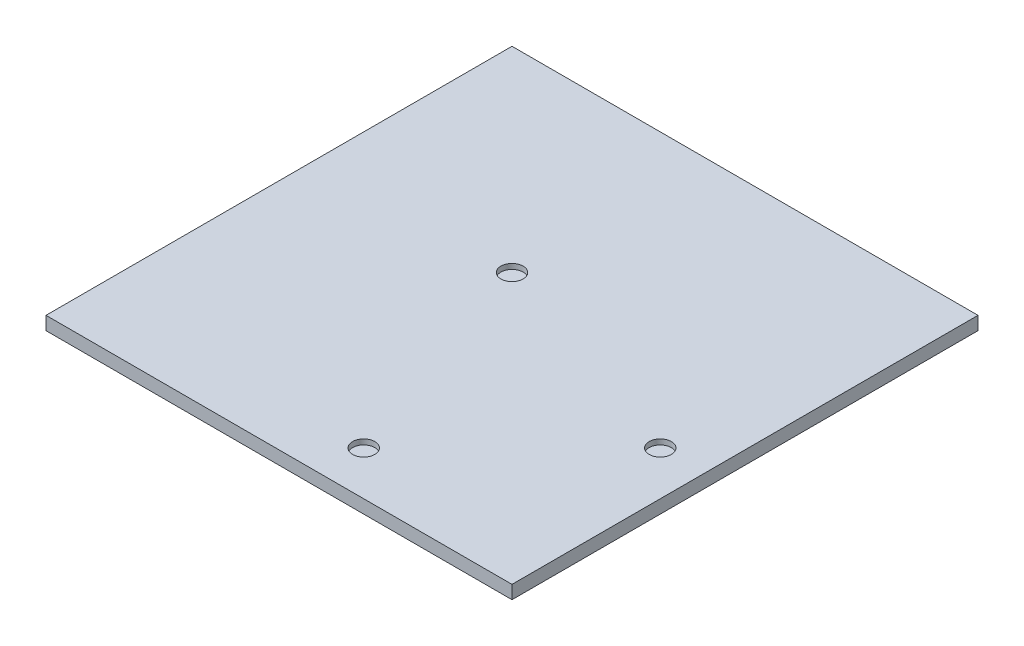
from build123d import *

# Parameters (mm, degrees)
SKETCH1_W           = 88.9
SKETCH1_H           = 88.9
BOSS_EXTRUDE1_DEPTH = 2.54
SKETCH3_R           = 2.125
CUT_EXTRUDE1_DEPTH  = 1


with BuildPart() as part:
    # Sketch1 → Boss-Extrude1 (new body)
    with BuildSketch(Plane(origin=(0, 0, 0), x_dir=(1, 0, 0), z_dir=(0, 1, 0))):
        Rectangle(SKETCH1_W, SKETCH1_H)
    extrude(amount=BOSS_EXTRUDE1_DEPTH)

    # Sketch3 → Cut-Extrude1 (cut)
    with BuildSketch(Plane(origin=(0, 2.54, 0), x_dir=(1, 0, 0), z_dir=(0, 1, 0))):
        with Locations(Location((-7.071067812, 7.071067812, 0), (0, 0, 270))):
            Circle(SKETCH3_R)
        with Locations(Location((36.062445841, -7.778174593, 0), (0, 0, 270))):
            Circle(SKETCH3_R)
        with Locations(Location((7.778174593, -36.062445841, 0), (0, 0, 270))):
            Circle(SKETCH3_R)
    extrude(amount=-CUT_EXTRUDE1_DEPTH, mode=Mode.SUBTRACT)


solid = part.part
